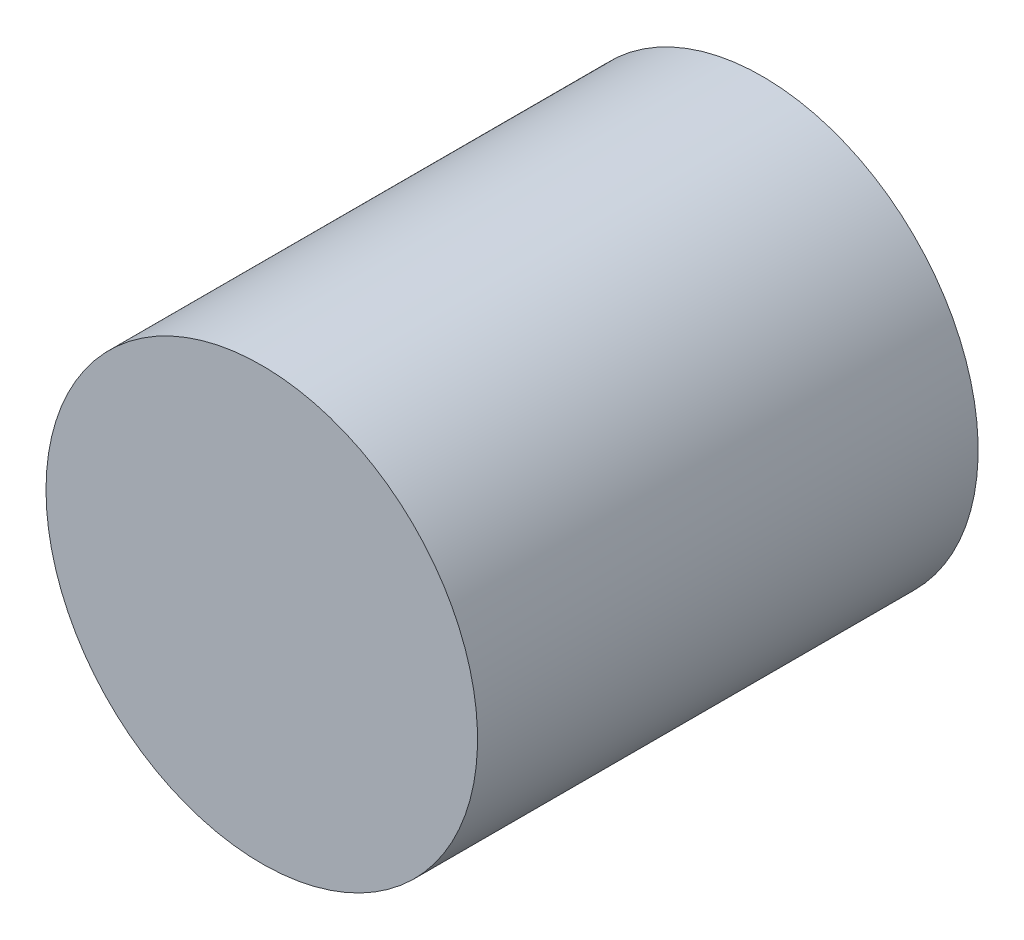
from build123d import *

# Parameters (mm, degrees)
SKETCH1_R           = 12.5
BOSS_EXTRUDE1_DEPTH = 29


with BuildPart() as part:
    # Sketch1 → Boss-Extrude1 (new body)
    with BuildSketch(Plane.XY):
        with Locations(Location((0, 0, 0), (0, 0, 180))):
            Circle(SKETCH1_R)
    extrude(amount=BOSS_EXTRUDE1_DEPTH)


solid = part.part
